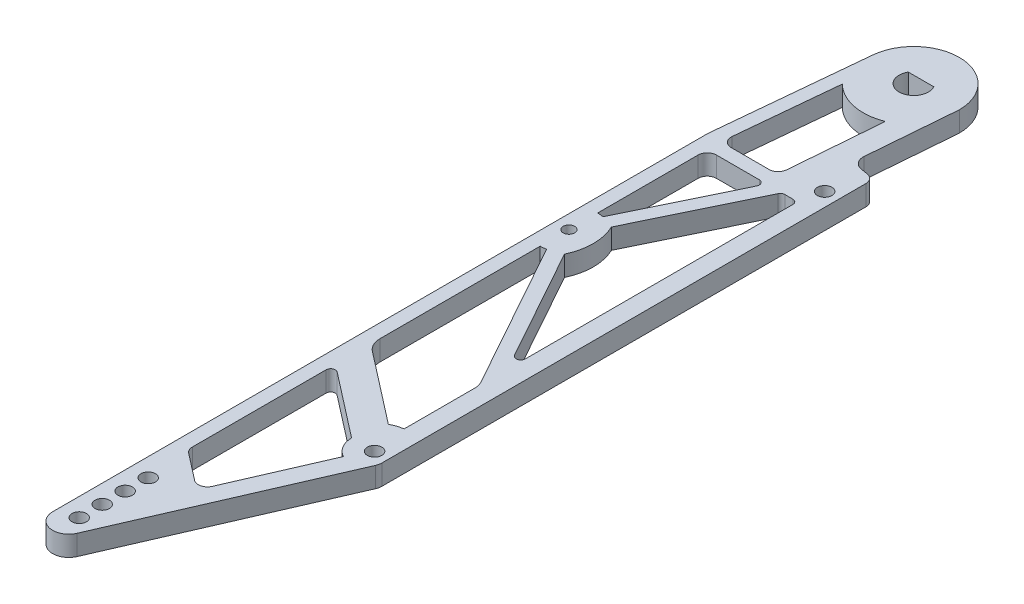
from build123d import *

# Parameters (mm, degrees)
SKETCH2_R           = 2
SKETCH2_R_2         = 1.5875
SKETCH2_R_3         = 1.999999991
BOSS_EXTRUDE1_DEPTH = 5.588


with BuildPart() as part:
    # Sketch2 → Boss-Extrude1 (new body)
    with BuildSketch(Plane(origin=(0, 0, 0), x_dir=(1, 0, 0), z_dir=(0, 1, 0))):
        with BuildLine():
            ThreePointArc((17.295902343, -30.526810701), (16.688093876, -28.878103365), (15.15555913, -28.018449791))
            Line((15.15555913, -28.018449791), (13.238676936, -27.713033224))
            ThreePointArc((13.238676936, -27.713033224), (11.241051513, -26.538356195), (10.573787778, -24.319092227))
            Line((10.573787778, -24.319092227), (12.5603, 0))
            ThreePointArc((12.5603, 0), (0.603657177, 12.545785512), (-12.502275592, 1.2059192))
            Line((-12.502275592, 1.2059192), (-16.498266045, -40.222207921))
            ThreePointArc((-16.498266045, -40.222207921), (-16.507064815, -40.344000039), (-16.51, -40.466074291))
            Line((-16.51, -40.466074291), (-16.51, -221.328861788))
            ThreePointArc((-16.51, -221.328861788), (-12.970187584, -225.680718913), (-7.988667969, -223.101301399))
            Line((-7.988667969, -223.101301399), (16.979901226, -165.677523619))
            ThreePointArc((16.979901226, -165.677523619), (17.216065593, -164.934164738), (17.295902343, -164.158289667))
            Line((17.295902343, -164.158289667), (17.295902343, -30.526810701))
        make_face()
        with Locations(Location((-11.43, -219.075, 0), (0, 0, 270))):
            Circle(SKETCH2_R, mode=Mode.SUBTRACT)
        with Locations(Location((-11.43, -212.725, 0), (0, 0, 270))):
            Circle(SKETCH2_R, mode=Mode.SUBTRACT)
        with Locations(Location((-11.43, -206.375, 0), (0, 0, 270))):
            Circle(SKETCH2_R, mode=Mode.SUBTRACT)
        with Locations(Location((-11.43, -200.025, 0), (0, 0, 270))):
            Circle(SKETCH2_R, mode=Mode.SUBTRACT)
        with BuildLine():
            ThreePointArc((7.135902343, -162.410770806), (8.023611961, -165.648962244), (10.438542905, -167.981776143))
            Line((10.438542905, -167.981776143), (-0.534170778, -193.217289931))
            ThreePointArc((-0.534170778, -193.217289931), (-2.234040931, -194.665234867), (-4.420389569, -194.211381682))
            Line((-4.420389569, -194.211381682), (-11.716886202, -188.551043102))
            ThreePointArc((-11.716886202, -188.551043102), (-12.441018517, -187.661516081), (-12.7, -186.544128716))
            Line((-12.7, -186.544128716), (-12.7, -149.615408258))
            ThreePointArc((-12.7, -149.615408258), (-11.988693683, -148.474898999), (-10.651556899, -148.611951065))
            Line((-10.651556899, -148.611951065), (7.135902343, -162.410770806))
        make_face(mode=Mode.SUBTRACT)
        with BuildLine():
            ThreePointArc((12.215902343, -152.970817152), (10.520298026, -153.359206519), (8.923603828, -154.049487576))
            Line((8.923603828, -154.049487576), (-10.733772403, -138.80005889))
            ThreePointArc((-10.733772403, -138.80005889), (-12.182037035, -137.021004847), (-12.7, -134.786230117))
            Line((-12.7, -134.786230117), (-12.7, -90.4875))
            ThreePointArc((-12.7, -90.4875), (-11.888769677, -90.445936399), (-11.086035141, -90.321680879))
            Line((-11.086035141, -90.321680879), (11.575760855, -131.079432803))
            ThreePointArc((11.575760855, -131.079432803), (12.053263487, -132.272915946), (12.215902343, -133.548047069))
            Line((12.215902343, -133.548047069), (12.215902343, -152.970817152))
        make_face(mode=Mode.SUBTRACT)
        with Locations(Location((13.485902343, -162.410770806, 0), (0, 0, 270))):
            Circle(SKETCH2_R, mode=Mode.SUBTRACT)
        with Locations(Location((-12.7, -82.55, 0), (0, 0, 270))):
            Circle(SKETCH2_R_2, mode=Mode.SUBTRACT)
        with BuildLine():
            Line((-10.16, -44.337182032), (1.663048834, -44.337182032))
            ThreePointArc((1.663048834, -44.337182032), (2.739129831, -44.932682449), (2.806066447, -46.160725831))
            Line((2.806066447, -46.160725831), (-11.055993219, -74.784618621))
            ThreePointArc((-11.055993219, -74.784618621), (-11.873503915, -74.655646925), (-12.7, -74.6125))
            Line((-12.7, -74.6125), (-12.7, -46.877182032))
            ThreePointArc((-12.7, -46.877182032), (-11.956051224, -45.081130808), (-10.16, -44.337182032))
        make_face(mode=Mode.SUBTRACT)
        with BuildLine():
            ThreePointArc((-9.903213406, -40.527182032), (-11.783508673, -39.694838236), (-12.431479451, -37.743315662))
            Line((-12.431479451, -37.743315662), (-9.755434212, -9.99962016))
            ThreePointArc((-9.755434212, -9.99962016), (-2.756273581, -13.695395429), (5.127655889, -12.99492382))
            Line((5.127655889, -12.99492382), (3.069264048, -38.19397392))
            ThreePointArc((3.069264048, -38.19397392), (2.259083254, -39.854914801), (0.537695935, -40.527182032))
            Line((0.537695935, -40.527182032), (-9.903213406, -40.527182032))
        make_face(mode=Mode.SUBTRACT)
        with BuildLine():
            Line((-3.521718331, 2), (3.521718331, 2))
            ThreePointArc((3.521718331, 2), (0, -4.05), (-3.521718331, 2))
        make_face(mode=Mode.SUBTRACT)
        with BuildLine():
            ThreePointArc((-7.44734835, -89.025591197), (-5.976040897, -82.55), (-7.44734835, -76.074408803))
            Line((-7.44734835, -76.074408803), (7.575478058, -45.053638233))
            ThreePointArc((7.575478058, -45.053638233), (8.043996088, -44.531101035), (8.718495671, -44.337182032))
            Line((8.718495671, -44.337182032), (10.945902343, -44.337182032))
            ThreePointArc((10.945902343, -44.337182032), (11.843927955, -44.70915642), (12.215902343, -45.607182032))
            Line((12.215902343, -45.607182032), (12.215902343, -119.492817968))
            ThreePointArc((12.215902343, -119.492817968), (11.264685124, -120.722158254), (9.835937715, -120.109971535))
            Line((9.835937715, -120.109971535), (-7.44734835, -89.025591197))
        make_face(mode=Mode.SUBTRACT)
        with Locations(Location((13.485902343, -38.1, 0), (0, 0, 270))):
            Circle(SKETCH2_R_3, mode=Mode.SUBTRACT)
    extrude(amount=BOSS_EXTRUDE1_DEPTH)


solid = part.part
